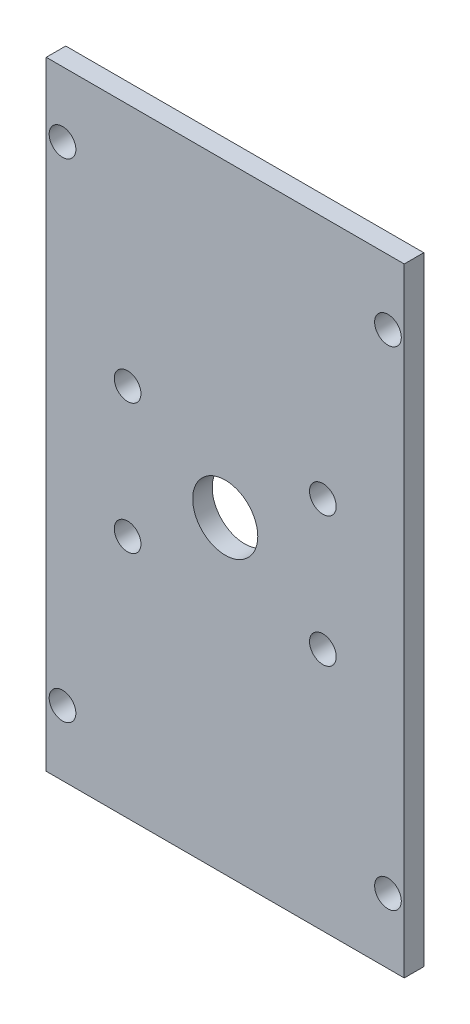
from build123d import *

# Parameters (mm, degrees)
SKETCH1_W                = 110
SKETCH1_H                = 190
BOSS_EXTRUDE1_DEPTH      = 6
M8_CLEARANCE_HOLE1_D     = 8.2
CUT_EXTRUDE1_REACH       = 111.936
SKETCH3_R                = 10
M8_CLEARANCE_HOLE2_D     = 8.2
M8_CLEARANCE_HOLE2_DEPTH = 19.75
M8_CLEARANCE_HOLE2_TIP   = 2.463528538


with BuildPart() as part:
    # Sketch1 → Boss-Extrude1 (new body)
    with BuildSketch(Plane.XY):
        Rectangle(SKETCH1_W, SKETCH1_H)
    extrude(amount=BOSS_EXTRUDE1_DEPTH)

    # M8 Clearance Hole1 (through all)
    with Locations(Plane(origin=(-50, 75, 6), x_dir=(1, 0, 0), z_dir=(0, 0, 1))):
        with Locations((0, 0), (100, 0), (100, -150), (0, -150)):
            Hole(M8_CLEARANCE_HOLE1_D / 2)

    # Sketch3 → Cut-Extrude1 (cut, up to next)
    with BuildSketch(Plane.XY.offset(6), mode=Mode.PRIVATE) as cut_extrude1_sk1:
        Circle(SKETCH3_R)
    cut_extrude1_tool1 = extrude(cut_extrude1_sk1.sketch, amount=-CUT_EXTRUDE1_REACH, mode=Mode.PRIVATE) & part.part
    add(cut_extrude1_tool1.solids().sort_by_distance((0, 0, 6))[0], mode=Mode.SUBTRACT)

    # M8 Clearance Hole2
    with Locations(Plane(origin=(-30, 20, 6), x_dir=(1, 0, 0), z_dir=(0, 0, 1))):
        with Locations((0, 0), (60, 0), (60, -40), (0, -40)):
            Hole(M8_CLEARANCE_HOLE2_D / 2, depth=M8_CLEARANCE_HOLE2_DEPTH)
            with Locations((0, 0, -(M8_CLEARANCE_HOLE2_DEPTH + M8_CLEARANCE_HOLE2_TIP / 2))):  # 118° drill point
                Cone(0, M8_CLEARANCE_HOLE2_D / 2, M8_CLEARANCE_HOLE2_TIP, mode=Mode.SUBTRACT)


solid = part.part
